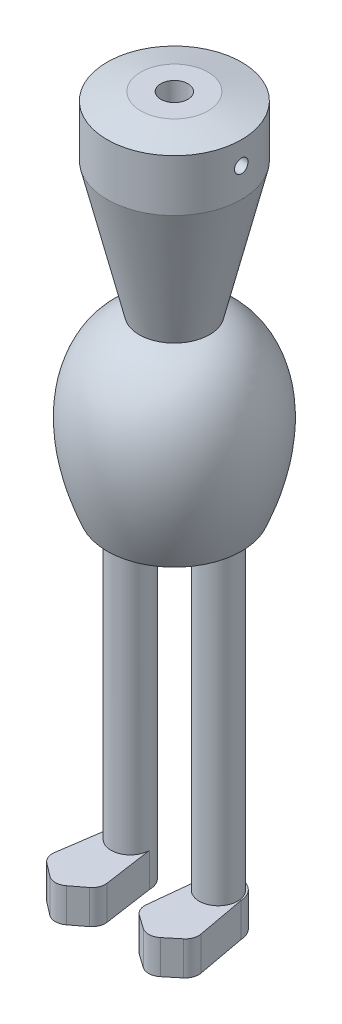
from build123d import *

# Parameters (mm, degrees)
SKETCH2_R               = 2.83366024
BOSS_EXTRUDE1_DEPTH     = 45
BOSS_EXTRUDE2_DEPTH     = 5
FILLET1_R               = 2
FILLET2_R               = 2
CUT_EXTRUDE2_DEPTH      = 115
CUT_EXTRUDE2_DEPTH_BACK = 96
SKETCH5_R               = 1
SKETCH8_R               = 2
CUT_EXTRUDE3_DEPTH      = 93


with BuildPart() as part:
    # Sketch1 → Revolve7 (revolve)
    with BuildSketch(Plane.XY, mode=Mode.PRIVATE) as revolve7_sk:
        Polygon((0, 0), (0, 28.475188422), (-4.956233819, 28.475188422), (-9.912467638, 27.282021021), (-9.912467638, 19.643055135), (-5.183583994, 0), align=None)
        with BuildLine():
            Line((0, -25.281339493), (0, 0))
            Line((0, 0), (-5.183583994, 0))
            add(Edge.make_bspline(
                [(-5.183583994, 0), (-8.573978987, -1.188883935), (-14.492218072, -9.39255897), (-12.177190855, -19.84099189), (-9.91246763, -25.281339493)],
                knots=[0, 0, 0, 0, 0.353823056, 1, 1, 1, 1], degree=3))
            Line((-9.91246763, -25.281339493), (-4.956233811, -25.281339493))
            Line((-4.956233811, -25.281339493), (0, -25.281339493))
        make_face()
    revolve(revolve7_sk.sketch.rotate(Axis((0, 53.654641341, 0), (0, -1, 0)), 270), axis=Axis((0, 53.654641341, 0), (0, -1, 0)))

    # Sketch2 → Boss-Extrude1 (add)
    with BuildSketch(Plane.XZ.offset(25.281339493)):
        with Locations(Location((-6.497142555, 0, 0), (0, 0, 90))):
            Circle(SKETCH2_R)
        with Locations(Location((6.497142555, 0, 0), (0, 0, 90))):
            Circle(SKETCH2_R)
    extrude(amount=BOSS_EXTRUDE1_DEPTH)

    # Sketch3 → Boss-Extrude2 (add)
    with BuildSketch(Plane.XZ.offset(70.281339493)):
        with BuildLine():
            Line((-9.330802795, 0), (-10.560252354, 8.471200618))
            Line((-10.560252354, 8.471200618), (-6.497142555, 11.576029804))
            Line((-6.497142555, 11.576029804), (-2.434032757, 8.471200618))
            Line((-2.434032757, 8.471200618), (-3.663482316, 0))
            ThreePointArc((-3.663482316, 0), (-6.497142555, -2.83366024), (-9.330802795, 0))
        make_face()
        with BuildLine():
            Line((2.917036225, 8.367030218), (7.097906526, 11.311372086))
            Line((7.097906526, 11.311372086), (11.03709893, 8.050760378))
            Line((11.03709893, 8.050760378), (9.478884483, -0.366172191))
            ThreePointArc((9.478884483, -0.366172191), (6.537086047, -3.087400346), (3.815857893, -0.14560191))
            Line((3.815857893, -0.14560191), (2.917036225, 8.367030218))
        make_face()
    extrude(amount=BOSS_EXTRUDE2_DEPTH)

    # Fillet1
    fillet1_edges = [part.edges().sort_by_distance(p)[0] for p in [
        (-6.497142555, -72.781339493, 11.576029804),
        (7.097906526, -72.781339493, 11.311372086),
    ]]
    fillet(fillet1_edges, radius=FILLET1_R)

    # Fillet2
    fillet2_edges = [part.edges().sort_by_distance(p)[0] for p in [
        (-2.434032757, -72.781339493, 8.471200618),
        (-10.560252354, -72.781339493, 8.471200618),
        (11.03709893, -72.781339493, 8.050760378),
        (2.917036225, -72.781339493, 8.367030218),
    ]]
    fillet(fillet2_edges, radius=FILLET2_R)

    # Sketch5 → Cut-Extrude2 (cut, two sides: drawn at the far end of the back side and taken through both)
    with BuildSketch(Plane(origin=(0, 0, 0), x_dir=(0, 0, -1), z_dir=(1, 0, 0)).offset(-CUT_EXTRUDE2_DEPTH_BACK)):
        with Locations(Location((0, 23.936282306, 0), (0, 0, 180))):
            Circle(SKETCH5_R)
    extrude(amount=CUT_EXTRUDE2_DEPTH + CUT_EXTRUDE2_DEPTH_BACK, mode=Mode.SUBTRACT)

    # Sketch8 → Cut-Extrude3 (cut)
    with BuildSketch(Plane(origin=(0, 28.475188422, 0), x_dir=(1, 0, 0), z_dir=(0, 1, 0))):
        with Locations(Location((0, 0, 0), (0, 0, 270))):
            Circle(SKETCH8_R)
    extrude(amount=-CUT_EXTRUDE3_DEPTH, mode=Mode.SUBTRACT)


solid = part.part
